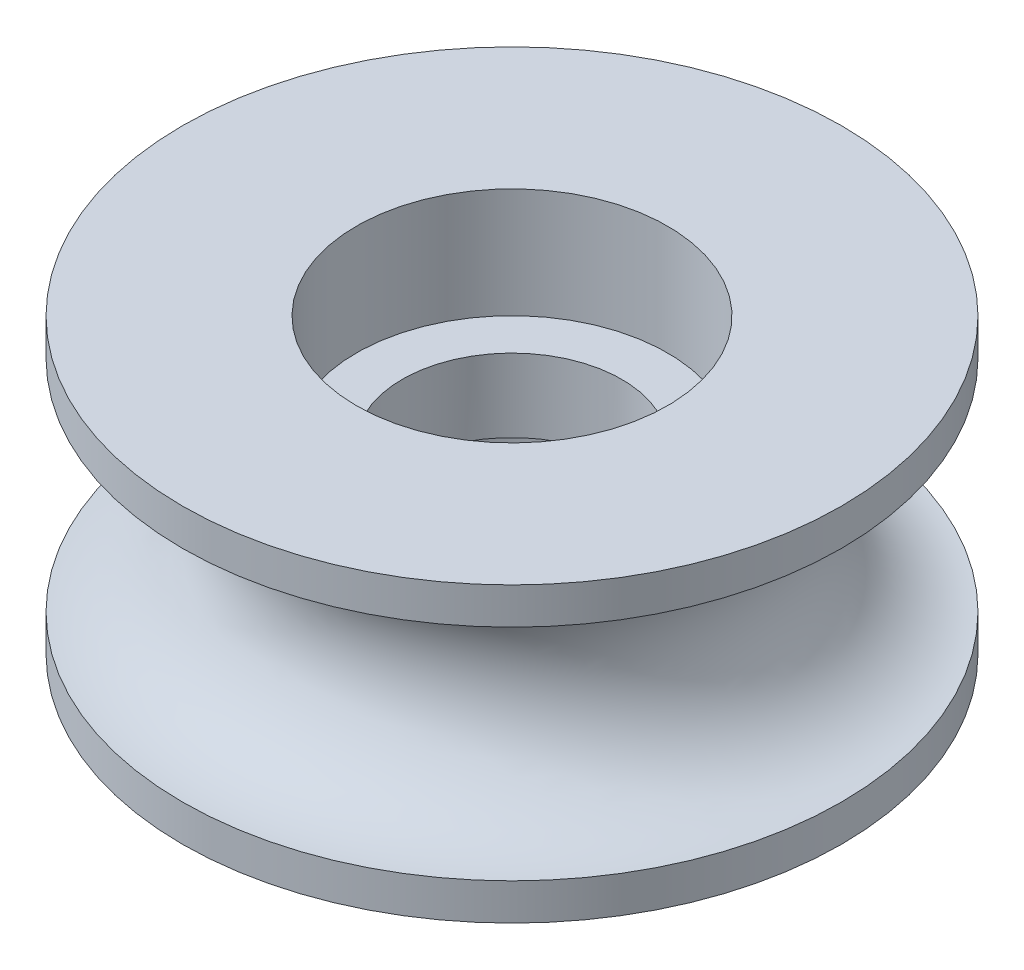
from build123d import *

# Parameters (mm, degrees)
SKETCH_1_R          = 9
EXTRUDE_1_DEPTH     = 8
SKETCH_5_R          = 3
SKETCH_2_R          = 3
CUT_EXTRUDE_1_DEPTH = 16.033296378
SKETCH_6_R          = 4.25
CUT_EXTRUDE_2_DEPTH = 3


with BuildPart() as part:
    # 草图1 → 凸台-拉伸1 (new body)
    with BuildSketch(Plane(origin=(0, 0, 0), x_dir=(1, 0, 0), z_dir=(0, 1, 0))):
        with Locations(Location((0, 0, 0), (0, 0, 270))):
            Circle(SKETCH_1_R)
    extrude(amount=EXTRUDE_1_DEPTH)

    # 草图5 → 切除-旋转1 (revolve, cut)
    with BuildSketch(Plane(origin=(0, 0, 0), x_dir=(0, 0, -1), z_dir=(1, 0, 0)), mode=Mode.PRIVATE) as cut_revolve_1_sk:
        with Locations((9, 4)):
            Circle(SKETCH_5_R)
    revolve(cut_revolve_1_sk.sketch.rotate(Axis((0, 8, 0), (0, -1, 0)), 180), axis=Axis((0, 8, 0), (0, -1, 0)), mode=Mode.SUBTRACT)

    # 草图2 → 切除-拉伸1 (cut, through all)
    with BuildSketch(Plane(origin=(0, 8, 0), x_dir=(1, 0, 0), z_dir=(0, 1, 0))):
        with Locations(Location((0, 0, 0), (0, 0, 270))):
            Circle(SKETCH_2_R)
    extrude(amount=-CUT_EXTRUDE_1_DEPTH, mode=Mode.SUBTRACT)

    # 草图6 → 切除-拉伸2 (cut)
    with BuildSketch(Plane(origin=(0, 8, 0), x_dir=(1, 0, 0), z_dir=(0, 1, 0))):
        with Locations(Location((0, 0, 0), (0, 0, 270))):
            Circle(SKETCH_6_R)
    cut_extrude_2 = extrude(amount=-CUT_EXTRUDE_2_DEPTH, mode=Mode.SUBTRACT)

    # 镜向2: 切除-拉伸2 across plane
    add(cut_extrude_2.mirror(Plane(origin=(0, 4, 0), x_dir=(0, 0, 1), z_dir=(0, -1, 0))), mode=Mode.SUBTRACT)


solid = part.part
